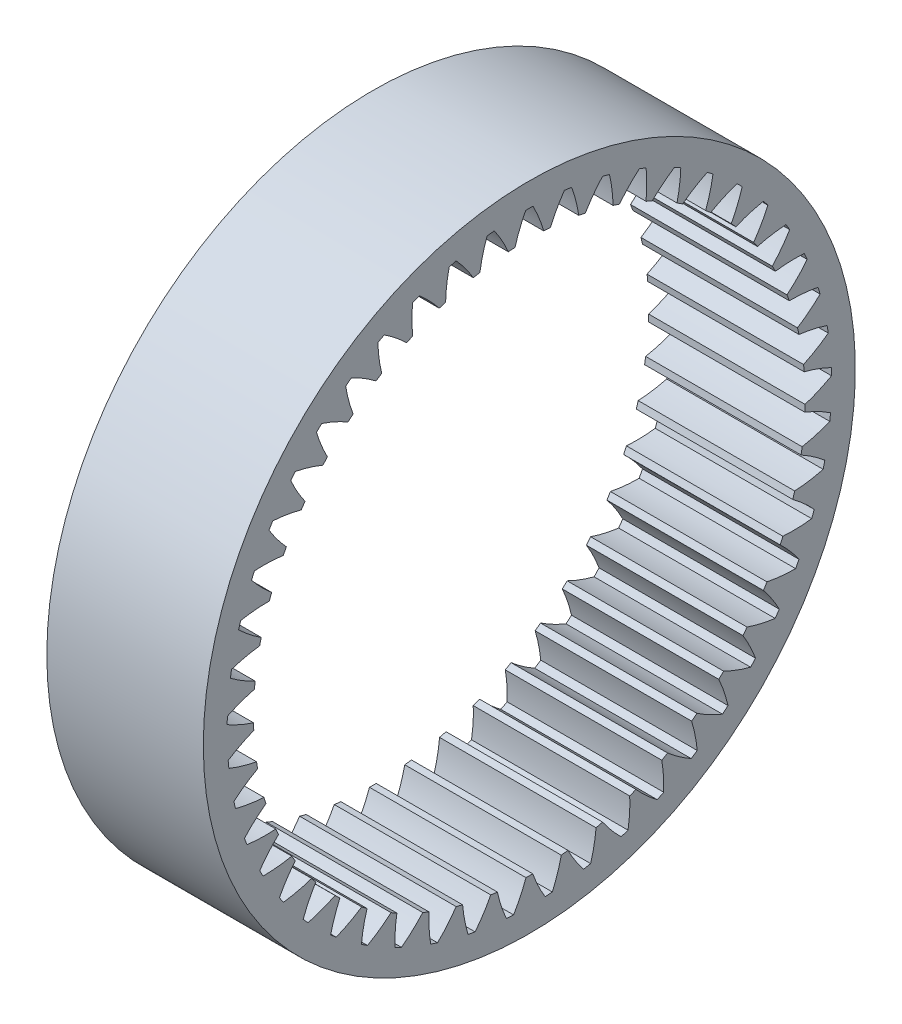
from build123d import *

# Parameters (mm, degrees)
BASPROSKE_W     = 12
BASPROSKE_H     = 3.85
TOOTHCUT_DEPTH  = 38.336309405
TEETHCUTS_COUNT = 49
TEETHCUTS_ANGLE = 352.653061224


with BuildPart() as part:
    # BasProSke → Base-Revolve (revolve)
    with BuildSketch(Plane(origin=(0, 0, 0), x_dir=(1, 0, 0), z_dir=(0, 1, 0)), mode=Mode.PRIVATE) as base_revolve_sk:
        with Locations((6, 23.075)):
            Rectangle(BASPROSKE_W, BASPROSKE_H)
    revolve(base_revolve_sk.sketch.rotate(Axis((-10, 0, 0), (1, 0, 0)), 180), axis=Axis((-10, 0, 0), (1, 0, 0)))

    # TooCutSke → ToothCut (cut, through all)
    with BuildSketch(Plane(origin=(0, 0, 0), x_dir=(0, 0, -1), z_dir=(1, 0, 0))):
        with BuildLine():
            ThreePointArc((1.105718832, 21.095641991), (0.744655315, 22.156044042), (0.27785324, 23.174334372))
            ThreePointArc((0.27785324, 23.174334372), (0, 23.176), (-0.27785324, 23.174334372))
            ThreePointArc((-0.27785324, 23.174334372), (-0.744655315, 22.156044042), (-1.105718832, 21.095641991))
            ThreePointArc((-1.105718832, 21.095641991), (0, 21.1246), (1.105718832, 21.095641991))
        make_face()
    toothcut = extrude(amount=TOOTHCUT_DEPTH, mode=Mode.SUBTRACT)

    # TeethCuts: ToothCut ×49 about axis
    teethcuts_axis = Axis((-10, 0, 0), (1, 0, 0))
    for i in range(1, TEETHCUTS_COUNT):
        add(toothcut.rotate(teethcuts_axis, i * TEETHCUTS_ANGLE / (TEETHCUTS_COUNT - 1)), mode=Mode.SUBTRACT)


solid = part.part
